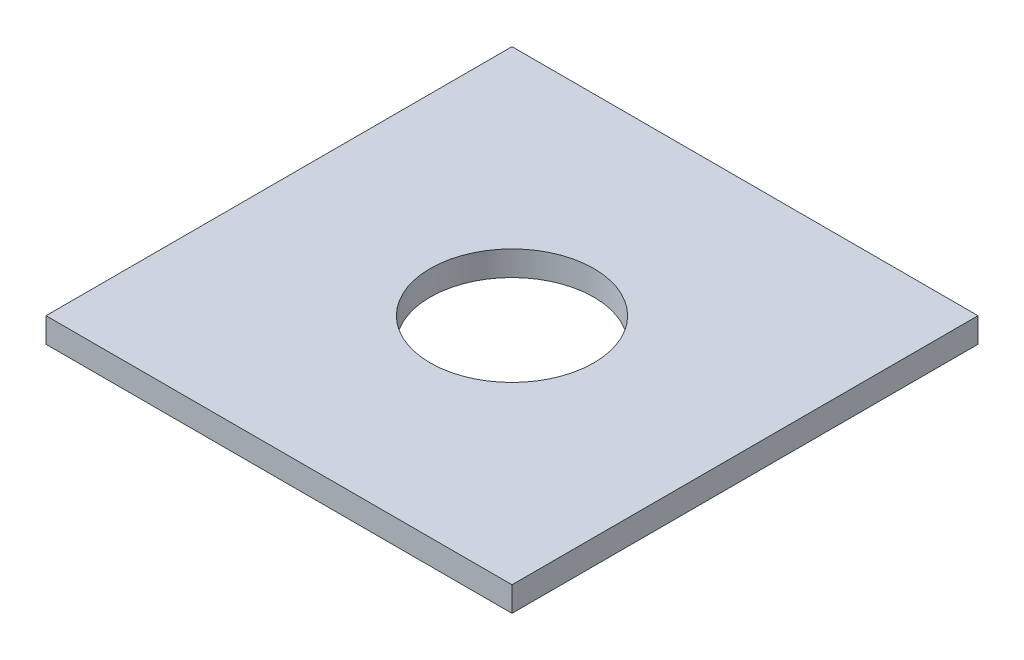
from build123d import *

# Parameters (mm, degrees)
SKETCH1_W           = 94
SKETCH1_H           = 94
BOSS_EXTRUDE1_DEPTH = 5
CUT_EXTRUDE1_REACH  = 68.656
SKETCH2_R           = 16.5


with BuildPart() as part:
    # Sketch1 → Boss-Extrude1 (new body)
    with BuildSketch(Plane(origin=(0, 0, 0), x_dir=(1, 0, 0), z_dir=(0, 1, 0))):
        Rectangle(SKETCH1_W, SKETCH1_H)
    extrude(amount=BOSS_EXTRUDE1_DEPTH)

    # Sketch2 → Cut-Extrude1 (cut, up to next)
    with BuildSketch(Plane(origin=(0, 5, 0), x_dir=(1, 0, 0), z_dir=(0, 1, 0)), mode=Mode.PRIVATE) as cut_extrude1_sk1:
        with Locations(Location((0, 0, 0), (0, 0, 270))):
            Circle(SKETCH2_R)
    cut_extrude1_tool1 = extrude(cut_extrude1_sk1.sketch, amount=-CUT_EXTRUDE1_REACH, mode=Mode.PRIVATE) & part.part
    add(cut_extrude1_tool1.solids().sort_by_distance((0, 5, 0))[0], mode=Mode.SUBTRACT)


solid = part.part
